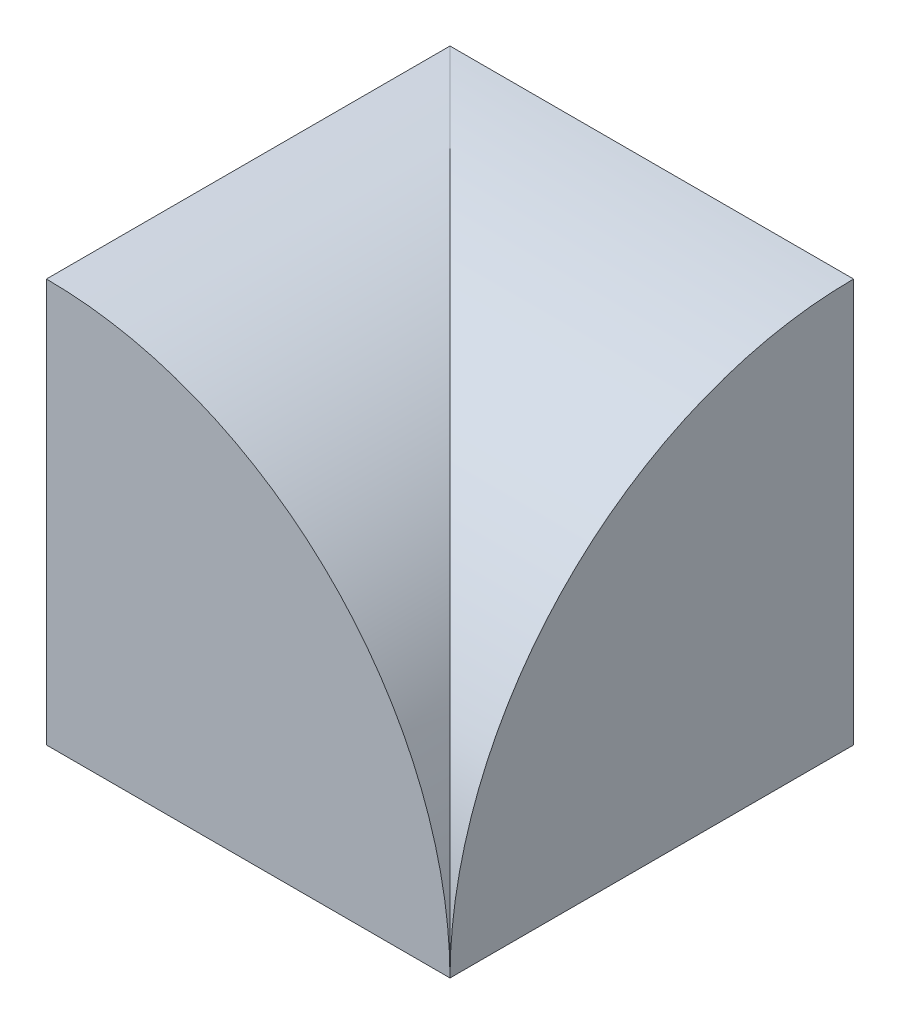
from build123d import *

# Parameters (mm, degrees)
Y_KSEKLIK_EKSTR_ZYON1_DEPTH = 20.5
SKETCH_1_R                  = 2.5
EXTRUDE_1_DEPTH             = 2.5
SKETCH_2_R                  = 2.5
EXTRUDE_2_DEPTH             = 2.5
SKETCH_3_W                  = 20.5
SKETCH_3_H                  = 20.5
REVOLVE_2_ANGLE             = 90
SKETCH_4_R                  = 2.5
EXTRUDE_3_DEPTH             = 2.5


with BuildPart() as part:
    # Çizim1 → Yükseklik-Ekstrüzyon1 (new body)
    with BuildSketch(Plane.XY):
        with BuildLine():
            Line((0, 20.5), (0, 0))
            Line((0, 0), (20.5, 0))
            ThreePointArc((20.5, 0), (14.495689014, 14.495689014), (0, 20.5))
        make_face()
    extrude(amount=Y_KSEKLIK_EKSTR_ZYON1_DEPTH)

    # Эскиз1 → Бобышка-Вытянуть1 (add)
    with BuildSketch(Plane.ZY):
        with Locations(Location((10.25, 10.25, 0), (0, 0, 270))):
            Circle(SKETCH_1_R)
    extrude(amount=EXTRUDE_1_DEPTH)

    # Эскиз2 → Бобышка-Вытянуть2 (add)
    with BuildSketch(Plane(origin=(0, 0, 0), x_dir=(-1, 0, 0), z_dir=(0, -1, 0))):
        with Locations(Location((-10.25, -10.25, 0), (0, 0, 90))):
            Circle(SKETCH_2_R)
    extrude(amount=EXTRUDE_2_DEPTH)

    # Эскиз3 → Повернуть2 (revolve)
    with BuildSketch(Plane(origin=(0, 0, 0), x_dir=(-1, 0, 0), z_dir=(0, 0, -1))):
        with Locations((-10.25, 10.25)):
            Rectangle(SKETCH_3_W, SKETCH_3_H)
    revolve(axis=Axis((0, 0, 0), (1, 0, 0)), revolution_arc=REVOLVE_2_ANGLE)

    # Эскиз4 → Бобышка-Вытянуть3 (add)
    with BuildSketch(Plane(origin=(0, 0, 0), x_dir=(-1, 0, 0), z_dir=(0, 0, -1))):
        with Locations(Location((-10.25, 10.25, 0), (0, 0, 180))):
            Circle(SKETCH_4_R)
    extrude(amount=EXTRUDE_3_DEPTH)


solid = part.part
